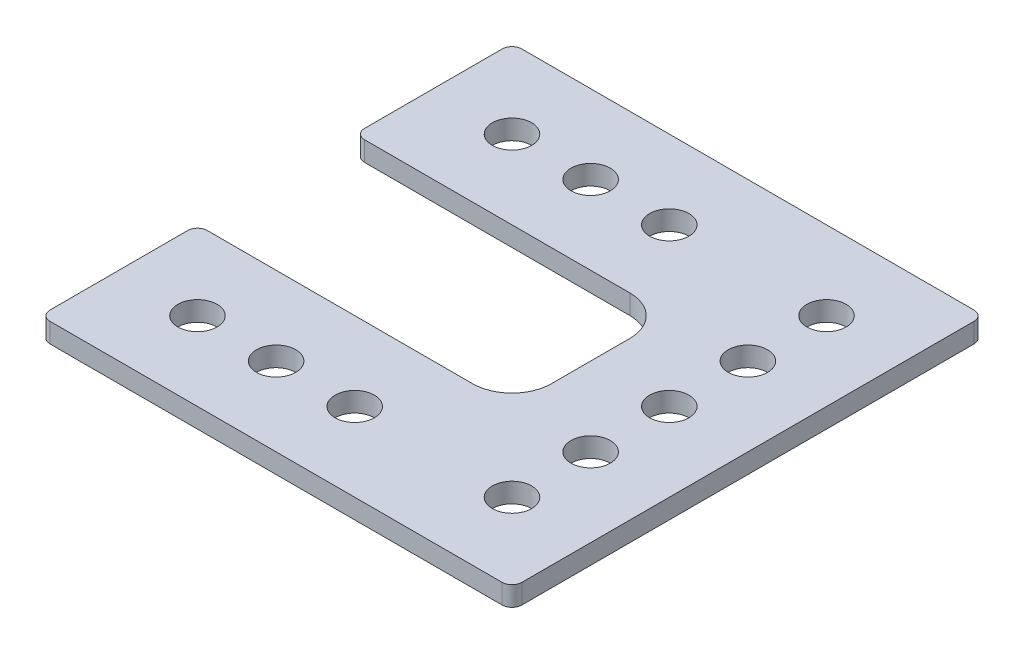
from build123d import *

# Parameters (mm, degrees)
BOSS_EXTRUDE1_DEPTH = 3.175
SKETCH2_R           = 3.175
CUT_EXTRUDE1_DEPTH  = 75.121121315
FILLET1_R           = 1.5875
FILLET2_R           = 6.35


with BuildPart() as part:
    # Sketch1 → Boss-Extrude1 (new body)
    with BuildSketch(Plane(origin=(0, 0, 0), x_dir=(1, 0, 0), z_dir=(0, 1, 0))):
        Polygon((-12.7, -38.1), (12.7, -38.1), (12.7, 38.1), (-12.7, 38.1), (-63.5, 38.1), (-63.5, 12.7), (-12.7, 12.7), (-12.7, -12.7), (-63.5, -12.7), (-63.5, -38.1), align=None)
    extrude(amount=BOSS_EXTRUDE1_DEPTH)

    # Sketch2 → Cut-Extrude1 (cut, through all)
    with BuildSketch(Plane(origin=(0, 3.175, 0), x_dir=(1, 0, 0), z_dir=(0, 1, 0))):
        with Locations(Location((0, 0, 0), (0, 0, 270))):
            Circle(SKETCH2_R)
        with Locations(Location((0, 12.7, 0), (0, 0, 270))):
            Circle(SKETCH2_R)
        with Locations(Location((0, 25.4, 0), (0, 0, 270))):
            Circle(SKETCH2_R)
        with Locations(Location((0, -25.4, 0), (0, 0, 90))):
            Circle(SKETCH2_R)
        with Locations(Location((0, -12.7, 0), (0, 0, 90))):
            Circle(SKETCH2_R)
        with Locations(Location((-50.8, 25.4, 0), (0, 0, 270))):
            Circle(SKETCH2_R)
        with Locations(Location((-38.1, 25.4, 0), (0, 0, 270))):
            Circle(SKETCH2_R)
        with Locations(Location((-25.4, 25.4, 0), (0, 0, 270))):
            Circle(SKETCH2_R)
        with Locations(Location((-25.4, -25.4, 0), (0, 0, 90))):
            Circle(SKETCH2_R)
        with Locations(Location((-38.1, -25.4, 0), (0, 0, 90))):
            Circle(SKETCH2_R)
        with Locations(Location((-50.8, -25.4, 0), (0, 0, 90))):
            Circle(SKETCH2_R)
    extrude(amount=-CUT_EXTRUDE1_DEPTH, mode=Mode.SUBTRACT)

    # Fillet1
    fillet1_edges = [part.edges().sort_by_distance(p)[0] for p in [
        (12.7, 1.5875, 38.1),
        (-63.5, 1.5875, 38.1),
        (-63.5, 1.5875, 12.7),
        (-63.5, 1.5875, -12.7),
        (-63.5, 1.5875, -38.1),
        (12.7, 1.5875, -38.1),
    ]]
    fillet(fillet1_edges, radius=FILLET1_R)

    # Fillet2
    fillet2_edges = [part.edges().sort_by_distance(p)[0] for p in [
        (-12.7, 1.5875, 12.7),
        (-12.7, 1.5875, -12.7),
    ]]
    fillet(fillet2_edges, radius=FILLET2_R)


solid = part.part
